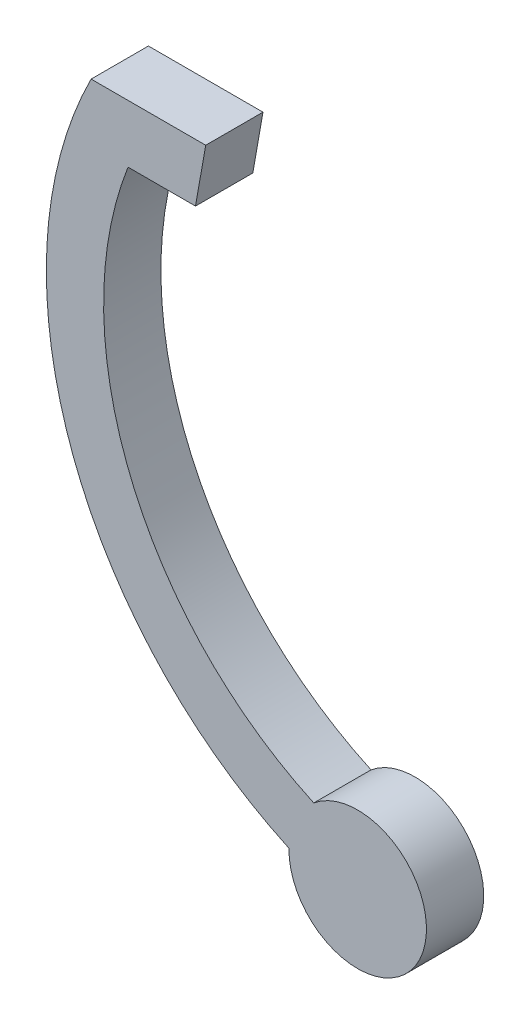
from build123d import *

# Parameters (mm, degrees)
BOSS_EXTRU_2_DEPTH           = 5
BOSS_EXTRU_8_START           = -1
BOSS_EXTRU_8_DEPTH           = 5
ENL_V_MAT_EXTRU_3_DEPTH      = 57.886804216
ENL_V_MAT_EXTRU_3_DEPTH_BACK = 57.886804216
ESQUISSE8_OUTSIDE_W          = 48.282
ESQUISSE8_OUTSIDE_H          = 25.106


with BuildPart() as part:
    # Esquisse1 → Boss.-Extru.2 (new body)
    with BuildSketch(Plane.XY):
        with BuildLine():
            ThreePointArc((5.586871342, -2.187891362), (5.144080872, -3.088435199), (4.557392942, -3.902584986))
            ThreePointArc((4.557392942, -3.902584986), (-5.144080872, 3.088435199), (5.586871342, -2.187891362))
        make_face()
    extrude(amount=BOSS_EXTRU_2_DEPTH)

    # Esquisse7 → Boss.-Extru.8 (add, symmetric)
    with BuildSketch(Plane(origin=(0, 0, 0), x_dir=(-1, 0, 0), z_dir=(0, 0, -1)).offset(BOSS_EXTRU_8_START)):
        with BuildLine():
            Line((23.267356356, 49.614121246), (13.267356356, 49.614121246))
            Line((13.267356356, 49.614121246), (14.157356645, 44.566678785))
            Line((14.157356645, 44.566678785), (20.047511648, 44.566678785))
            ThreePointArc((20.047511648, 44.566678785), (19.869115778, 21.373460498), (3.835346807, 4.614121246))
            ThreePointArc((3.835346807, 4.614121246), (5.409269967, 2.596112175), (5.999067404, 0.105784144))
            ThreePointArc((5.999067404, 0.105784144), (25.143375104, 21.19405426), (23.267356356, 49.614121246))
        make_face()
    extrude(amount=BOSS_EXTRU_8_DEPTH, both=True)

    # Esquisse8 outside → Enlèv. mat.-Extru.3 (cut, two sides: drawn at the far end of the back side and taken through both)
    with BuildSketch(Plane(origin=(0, 0, 0), x_dir=(1, 0, 0), z_dir=(0, 1, 0)).offset(-ENL_V_MAT_EXTRU_3_DEPTH_BACK)):
        with Locations((-10.588, -1)):
            Rectangle(ESQUISSE8_OUTSIDE_W, ESQUISSE8_OUTSIDE_H)
        Polygon((-31.025150446, 0), (-31.025150446, -5), (-4.47625447, -5), (6.185645272, -5), (6.185645272, 0), (-4.47625447, 0), align=None, mode=Mode.SUBTRACT)
    extrude(amount=ENL_V_MAT_EXTRU_3_DEPTH + ENL_V_MAT_EXTRU_3_DEPTH_BACK, mode=Mode.SUBTRACT)


solid = part.part
